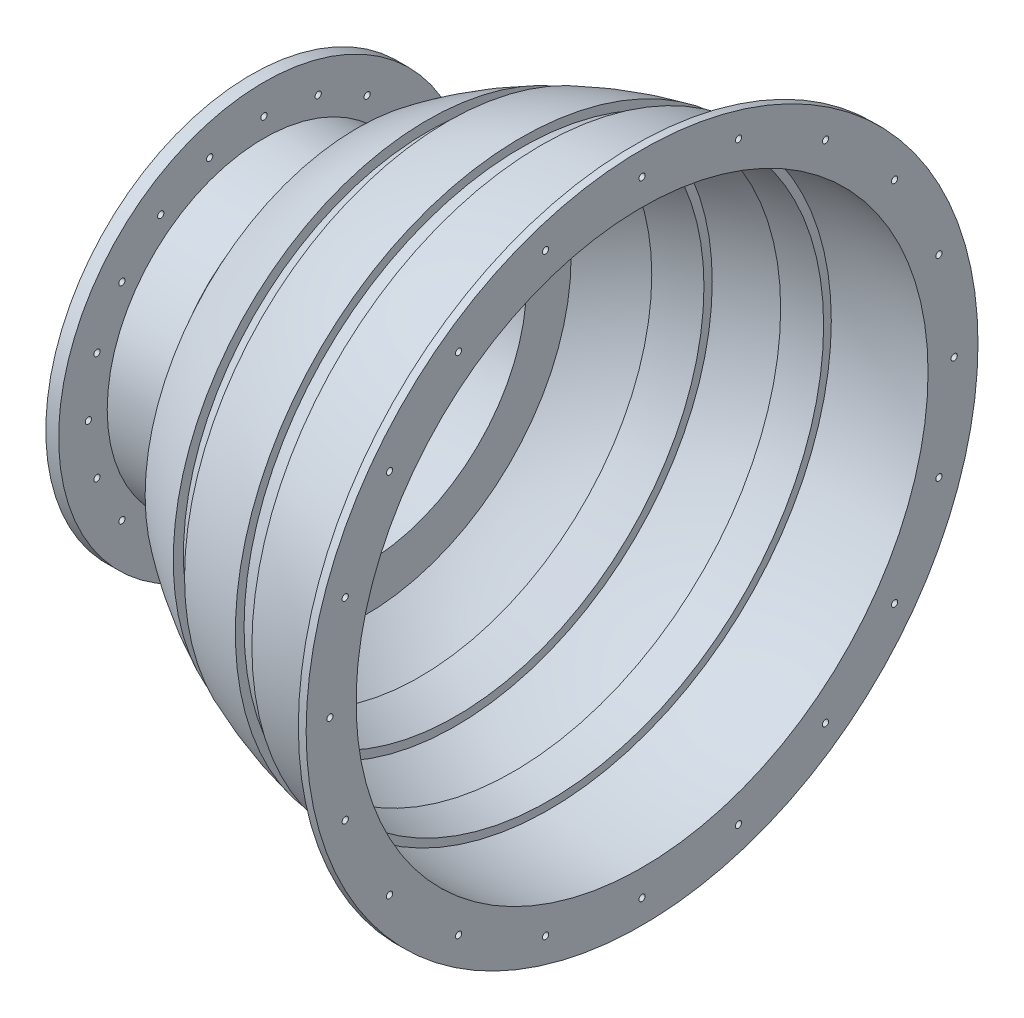
from build123d import *

# Parameters (mm, degrees)
SKETCH2_R          = 2
CUT_EXTRUDE1_DEPTH = 10
SKETCH4_R          = 2
CUT_EXTRUDE2_DEPTH = 10
CIRPATTERN1_COUNT  = 20


with BuildPart() as part:
    # Sketch1 → Revolve1 (revolve)
    with BuildSketch(Plane.XY, mode=Mode.PRIVATE) as revolve1_sk:
        with BuildLine():
            Line((-125.25, 131.564721686), (-117.02868173, 131.564721686))
            Line((-117.02868173, 131.564721686), (-117.02868173, 100.43549505))
            Line((-117.02868173, 100.43549505), (-82.619446827, 100.43549505))
            Line((-82.619446827, 100.43549505), (-57.31853881, 107.415055882))
            Line((-57.31853881, 107.415055882), (-57.31853881, 135.856766273))
            ThreePointArc((-57.31853881, 135.856766273), (-35.477914786, 150.453919829), (-12.31853881, 162.852833254))
            Line((-12.31853881, 162.852833254), (-12.31853881, 156.314729683))
            ThreePointArc((-12.31853881, 156.314729683), (-5.858433789, 159.39152107), (0.68146119, 162.294859801))
            Line((0.68146119, 162.294859801), (0.68146119, 168.601138577))
            ThreePointArc((0.68146119, 168.601138577), (23.850604977, 176.906454941), (47.68146119, 183.060948904))
            Line((47.68146119, 183.060948904), (47.68146119, 177.466835722))
            ThreePointArc((47.68146119, 177.466835722), (54.165571379, 178.833135663), (60.68146119, 180.038805792))
            Line((60.68146119, 180.038805792), (60.68146119, 185.45946322))
            ThreePointArc((60.68146119, 185.45946322), (90.388066416, 188.512081052), (120.25, 188.255581006))
            Line((120.25, 188.255581006), (120.25, 215.255581006))
            Line((120.25, 215.255581006), (125.25, 215.255581006))
            Line((125.25, 215.255581006), (125.25, 183.255581006))
            ThreePointArc((125.25, 183.255581006), (95.391021127, 183.71382792), (65.666226876, 180.849353038))
            Line((65.666226876, 180.849353038), (65.666226876, 175.928632358))
            Line((65.666226876, 175.928632358), (42.68146119, 171.378159884))
            Line((42.68146119, 171.378159884), (42.68146119, 176.29819421))
            ThreePointArc((42.68146119, 176.29819421), (24.027975408, 171.028508313), (5.803872294, 164.425161668))
            Line((5.803872294, 164.425161668), (5.803872294, 159.105687216))
            Line((5.803872294, 159.105687216), (-17.31853881, 148.78572312))
            Line((-17.31853881, 148.78572312), (-17.31853881, 153.78572312))
            ThreePointArc((-17.31853881, 153.78572312), (-35.236437934, 143.593855649), (-52.31853881, 132.055783832))
            Line((-52.31853881, 132.055783832), (-52.31853881, 103.531785615))
            Line((-52.31853881, 103.531785615), (-81.66759211, 95.43549505))
            Line((-81.66759211, 95.43549505), (-125.25, 95.43549505))
            Line((-125.25, 95.43549505), (-125.25, 131.564721686))
        make_face()
    revolve(revolve1_sk.sketch.rotate(Axis((149.391850052, 0, 0), (-1, 0, 0)), 90), axis=Axis((149.391850052, 0, 0), (-1, 0, 0)))

    # Sketch2 → Cut-Extrude1 (cut)
    with BuildSketch(Plane.ZY.offset(125.25)):
        with Locations((0, 112.5)):
            Circle(SKETCH2_R)
    cut_extrude1 = extrude(amount=-CUT_EXTRUDE1_DEPTH, mode=Mode.SUBTRACT)

    # Sketch4 → Cut-Extrude2 (cut)
    with BuildSketch(Plane.ZY.offset(-120.25)):
        with Locations((0, 200)):
            Circle(SKETCH4_R)
    cut_extrude2 = extrude(amount=-CUT_EXTRUDE2_DEPTH, mode=Mode.SUBTRACT)

    # CirPattern1: Cut-Extrude1, Cut-Extrude2 ×20 about axis
    cirpattern1_axis = Axis((0, 0, 0), (1, 0, 0))
    add([cut_extrude1.rotate(cirpattern1_axis, i * 360 / CIRPATTERN1_COUNT) for i in range(1, CIRPATTERN1_COUNT)], mode=Mode.SUBTRACT)
    add([cut_extrude2.rotate(cirpattern1_axis, i * 360 / CIRPATTERN1_COUNT) for i in range(1, CIRPATTERN1_COUNT)], mode=Mode.SUBTRACT)


solid = part.part
